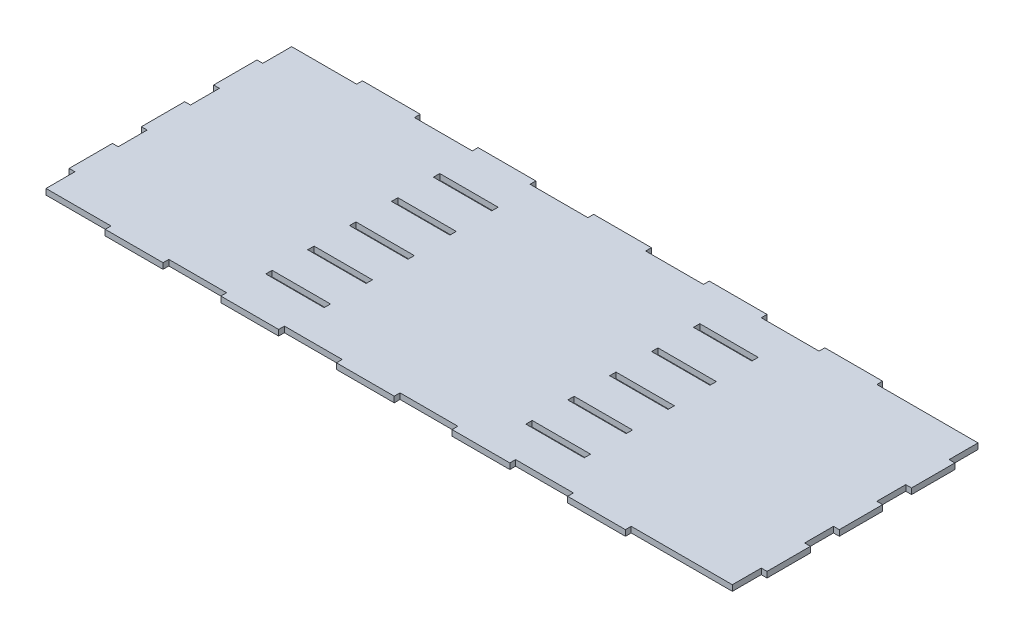
from build123d import *

# Parameters (mm, degrees)
EXTRUDE_1_DEPTH     = 4
SKETCH_3_W          = 40.4
SKETCH_3_H          = 4.4
CUT_EXTRUDE_1_DEPTH = 510.640069068


with BuildPart() as part:
    # Эскиз1 → Бобышка-Вытянуть1 (new body)
    with BuildSketch(Plane(origin=(0, 0, 0), x_dir=(1, 0, 0), z_dir=(0, 1, 0))):
        Polygon((0, 0), (0, 20), (-4, 20), (-4, 50), (0, 50), (0, 70), (-4, 70), (-4, 100), (0, 100), (0, 120), (-4, 120), (-4, 150), (0, 150), (0, 170), (45, 170), (45, 174), (85, 174), (85, 170), (125, 170), (125, 174), (165, 174), (165, 170), (205, 170), (205, 174), (245, 174), (245, 170), (285, 170), (285, 174), (325, 174), (325, 170), (365, 170), (365, 174), (405, 174), (405, 170), (475, 170), (475, 150), (479, 150), (479, 120), (475, 120), (475, 100), (479, 100), (479, 70), (475, 70), (475, 50), (479, 50), (479, 20), (475, 20), (475, 0), (405, 0), (405, -4), (365, -4), (365, 0), (325, 0), (325, -4), (285, -4), (285, 0), (245, 0), (245, -4), (205, -4), (205, 0), (165, 0), (165, -4), (125, -4), (125, 0), (85, 0), (85, -4), (45, -4), (45, 0), align=None)
    extrude(amount=-EXTRUDE_1_DEPTH)

    # Эскиз3 → Вырез-Вытянуть1 (cut, through all)
    with BuildSketch(Plane(origin=(0, 0, 0), x_dir=(1, 0, 0), z_dir=(0, 1, 0))):
        with Locations((147.5, 27)):
            Rectangle(SKETCH_3_W, SKETCH_3_H)
        with Locations((327.5, 27)):
            Rectangle(SKETCH_3_W, SKETCH_3_H)
        with Locations((147.5, 56)):
            Rectangle(SKETCH_3_W, SKETCH_3_H)
        with Locations((327.5, 56)):
            Rectangle(SKETCH_3_W, SKETCH_3_H)
        with Locations((147.5, 85)):
            Rectangle(SKETCH_3_W, SKETCH_3_H)
        with Locations((327.5, 85)):
            Rectangle(SKETCH_3_W, SKETCH_3_H)
        with Locations((147.5, 114)):
            Rectangle(SKETCH_3_W, SKETCH_3_H)
        with Locations((327.5, 114)):
            Rectangle(SKETCH_3_W, SKETCH_3_H)
        with Locations((147.5, 143)):
            Rectangle(SKETCH_3_W, SKETCH_3_H)
        with Locations((327.5, 143)):
            Rectangle(SKETCH_3_W, SKETCH_3_H)
    extrude(amount=-CUT_EXTRUDE_1_DEPTH, mode=Mode.SUBTRACT)


solid = part.part
